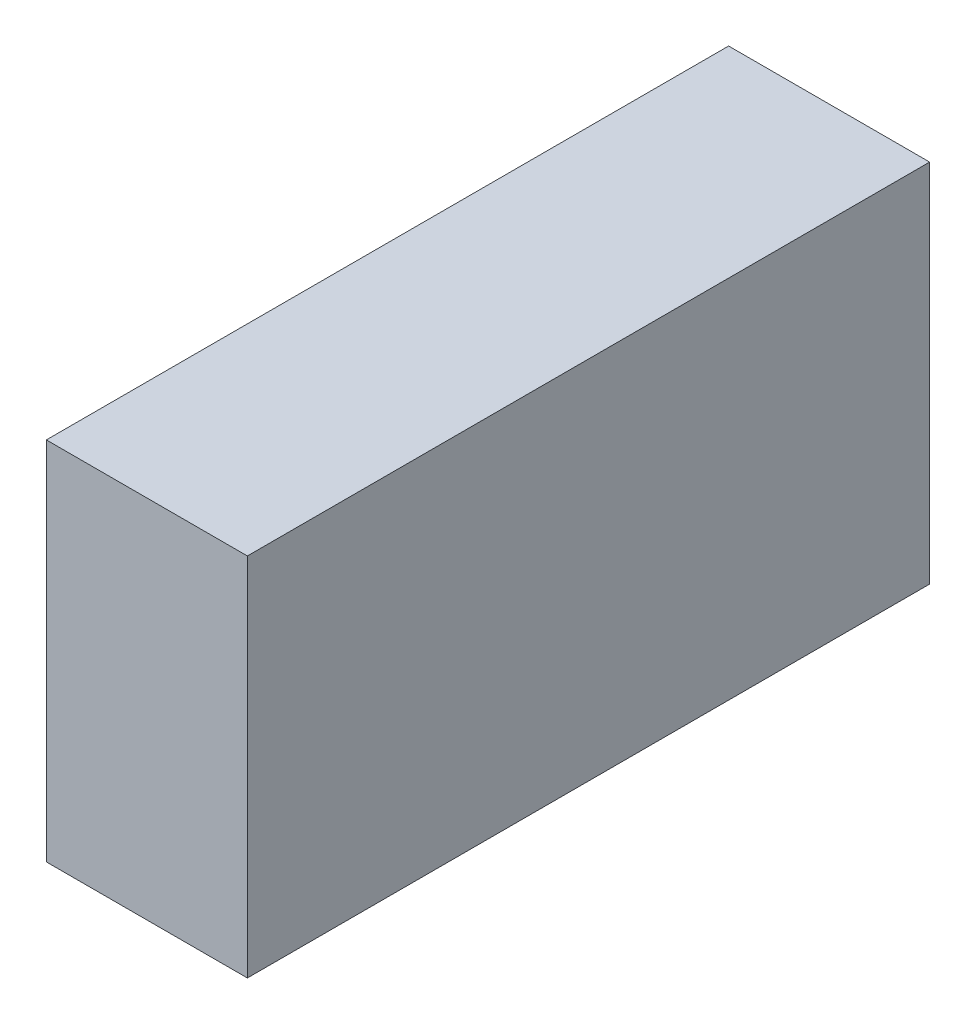
from build123d import *

# Parameters (mm, degrees)
SKETCH1_W           = 30
SKETCH1_H           = 16.5
BOSS_EXTRUDE1_DEPTH = 56


with BuildPart() as part:
    # Sketch1 → Boss-Extrude1 (new body)
    with BuildSketch(Plane(origin=(0, 0, 0), x_dir=(0, 1, 0), z_dir=(0, 0, 1))):
        Rectangle(SKETCH1_W, SKETCH1_H)
    extrude(amount=BOSS_EXTRUDE1_DEPTH)


solid = part.part
